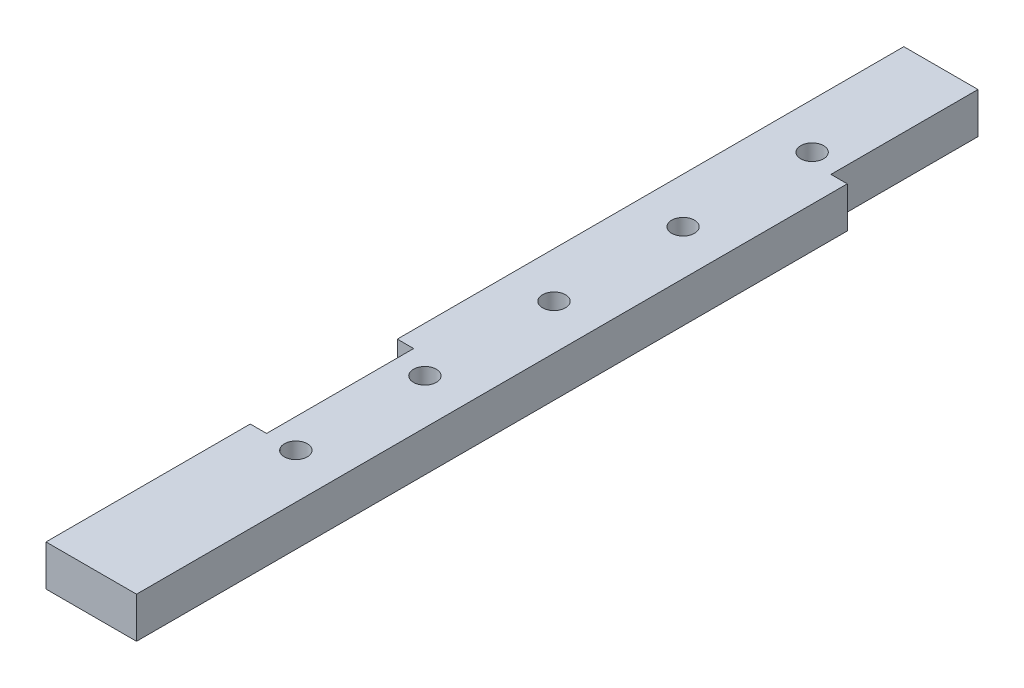
from build123d import *

# Parameters (mm, degrees)
SKETCH1_W           = 69.85
SKETCH1_H           = 6.35
BOSS_EXTRUDE1_DEPTH = 120.65
CUT_EXTRUDE1_DEPTH  = 140.555607197
SKETCH3_W           = 5.08
SKETCH3_H           = 120.65
CUT_EXTRUDE2_DEPTH  = 42.164
SKETCH4_W           = 2.54
SKETCH4_H           = 22.86
CUT_EXTRUDE3_DEPTH  = 6.35
SKETCH5_W           = 11.5316
SKETCH5_H           = 12.7
BOSS_EXTRUDE2_DEPTH = 6.35
SKETCH6_R           = 1.778
CUT_EXTRUDE4_DEPTH  = 6.35


with BuildPart() as part:
    # Sketch1 → Boss-Extrude1 (new body)
    with BuildSketch(Plane.XY):
        with Locations((34.925, 3.175)):
            Rectangle(SKETCH1_W, SKETCH1_H)
    extrude(amount=BOSS_EXTRUDE1_DEPTH)

    # Sketch2 → Cut-Extrude1 (cut, through all)
    with BuildSketch(Plane(origin=(0, 6.35, 0), x_dir=(1, 0, 0), z_dir=(0, 1, 0))):
        Polygon((35.923749516, 0), (35.923749516, -37.802999389), (69.85, -55.962276793), (69.85, 0), align=None)
    extrude(amount=-CUT_EXTRUDE1_DEPTH, mode=Mode.SUBTRACT)

    # Sketch3 → Cut-Extrude2 (cut)
    with BuildSketch(Plane.XZ):
        Polygon((19.1516, 120.65), (19.1516, 0), (35.923749516, 0), (35.923749516, 37.802999389), (69.85, 55.962276793), (69.85, 120.65), align=None)
        with Locations((2.54, 60.325)):
            Rectangle(SKETCH3_W, SKETCH3_H)
    extrude(amount=-CUT_EXTRUDE2_DEPTH, mode=Mode.SUBTRACT)

    # Sketch4 → Cut-Extrude3 (cut)
    with BuildSketch(Plane.XZ):
        with Locations((6.35, 77.47)):
            Rectangle(SKETCH4_W, SKETCH4_H)
        with Locations((17.8816, -1.27)):
            Rectangle(SKETCH4_W, SKETCH4_H)
    extrude(amount=-CUT_EXTRUDE3_DEPTH, mode=Mode.SUBTRACT)

    # Sketch5 → Boss-Extrude2 (add)
    with BuildSketch(Plane.XZ):
        with Locations((10.8458, -6.35)):
            Rectangle(SKETCH5_W, SKETCH5_H)
    extrude(amount=-BOSS_EXTRUDE2_DEPTH)

    # Sketch6 → Cut-Extrude4 (cut)
    with BuildSketch(Plane.XZ):
        with Locations(Location((12.1666, 88.9, 0), (0, 0, 270))):
            Circle(SKETCH6_R)
        with Locations(Location((12.1666, 68.834, 0), (0, 0, 270))):
            Circle(SKETCH6_R)
        Circle(SKETCH6_R)
        with Locations(Location((12.1666, 48.768, 0), (0, 0, 270))):
            Circle(SKETCH6_R)
        with Locations(Location((12.1666, 28.702, 0), (0, 0, 270))):
            Circle(SKETCH6_R)
        with Locations(Location((12.1666, 8.636, 0), (0, 0, 270))):
            Circle(SKETCH6_R)
    extrude(amount=-CUT_EXTRUDE4_DEPTH, mode=Mode.SUBTRACT)


solid = part.part
